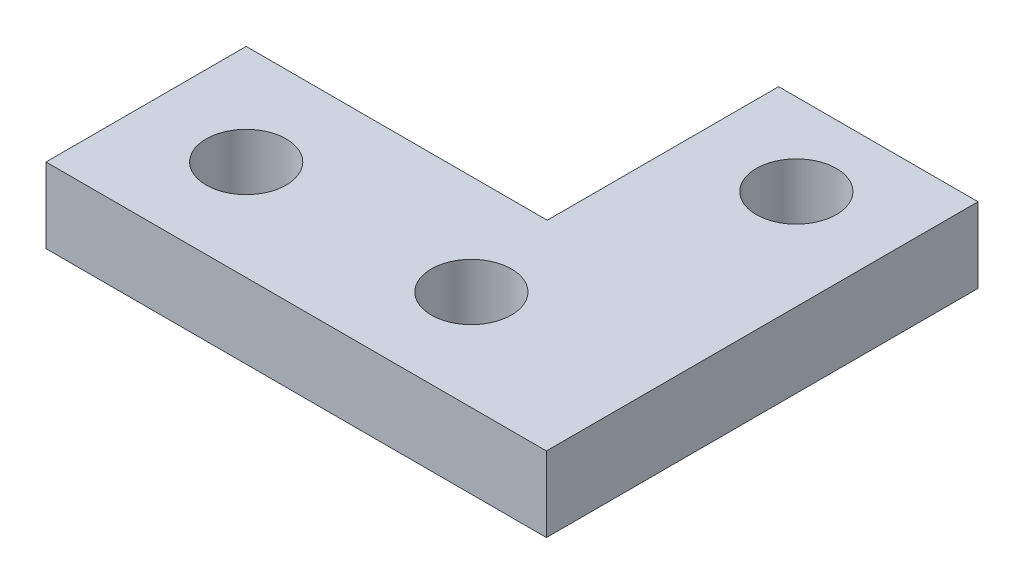
from build123d import *

# Parameters (mm, degrees)
SKETCH_1_R      = 1.6
EXTRUDE_1_DEPTH = 3


with BuildPart() as part:
    # 草图1 → 凸台-拉伸1 (new body)
    with BuildSketch(Plane(origin=(0, 0, 0), x_dir=(1, 0, 0), z_dir=(0, 1, 0))):
        Polygon((0, 0), (20, 0), (20, 8), (20, 17.247388719), (12.032168205, 17.247388719), (12.032168205, 8), (0, 8), align=None)
        with Locations(Location((4, 4, 0), (0, 0, 270))):
            Circle(SKETCH_1_R, mode=Mode.SUBTRACT)
        with Locations(Location((13, 4, 0), (0, 0, 270))):
            Circle(SKETCH_1_R, mode=Mode.SUBTRACT)
        with Locations(Location((16.016084103, 13.971325548, 0), (0, 0, 270))):
            Circle(SKETCH_1_R, mode=Mode.SUBTRACT)
    extrude(amount=EXTRUDE_1_DEPTH)


solid = part.part
